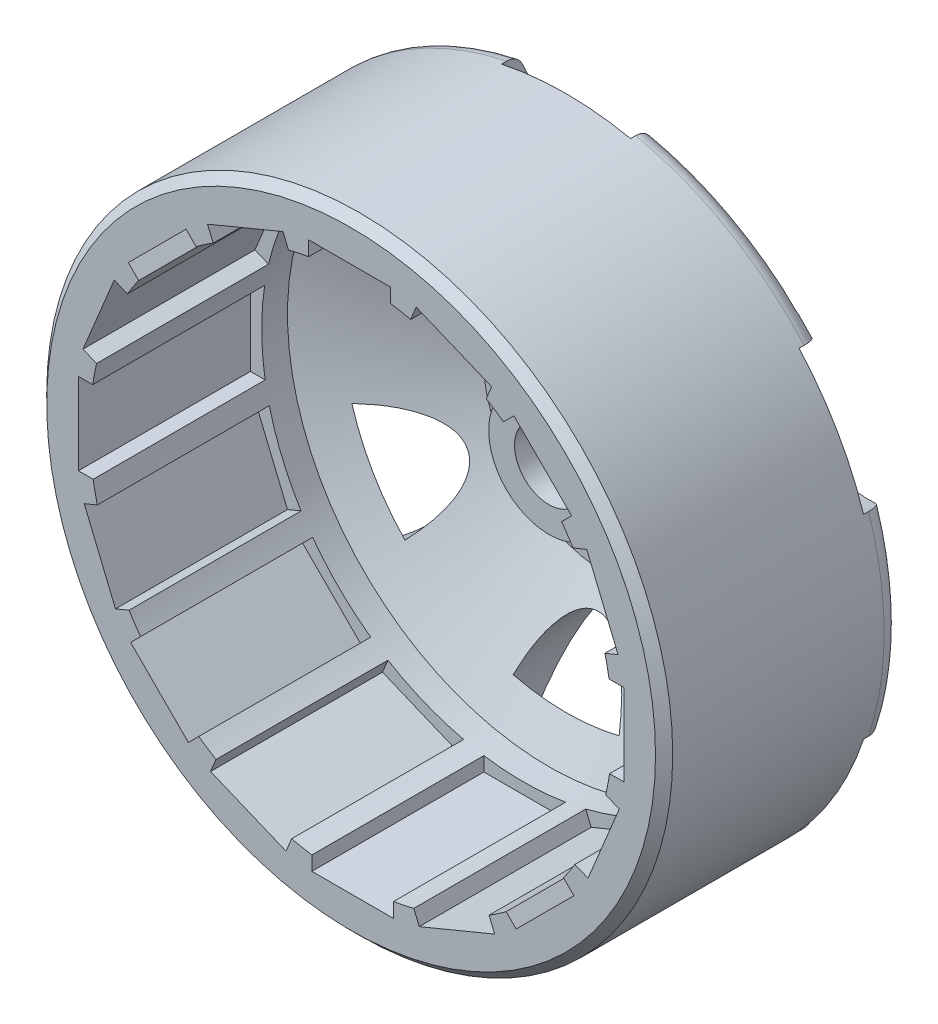
from build123d import *

# Parameters (mm, degrees)
SKETCH3_R          = 4
CUT_EXTRUDE2_DEPTH = 20
SKETCH4_RX         = 17.609555042
SKETCH4_RY         = 7.5
CUT_EXTRUDE4_DEPTH = 10
CUT_EXTRUDE5_START = -20
CUT_EXTRUDE5_DEPTH = 20


with BuildPart() as part:
    # Sketch1 → Revolve1 (revolve)
    with BuildSketch(Plane(origin=(0, 0, 0), x_dir=(1, 0, 0), z_dir=(0, 1, 0)), mode=Mode.PRIVATE) as revolve1_sk:
        with BuildLine():
            Line((0, 14.5), (-7, 14.5))
            Line((-7, 14.5), (-7, 12))
            Line((-7, 12), (-18.32, 12))
            Line((-18.32, 12), (-35.219110084, 4.413431506))
            ThreePointArc((-35.219110084, 4.413431506), (-36.079020573, 3.675548277), (-36.4, 2.588860688))
            Line((-36.4, 2.588860688), (-36.4, -22))
            Line((-36.4, -22), (-35.4, -23))
            Line((-35.4, -23), (-30.4, -23))
            Line((-30.4, -23), (-30.4, 0))
            Line((-30.4, 0), (-14.7, 7.048248385))
            Line((-14.7, 7.048248385), (-10.65, 7.048248385))
            Line((-10.65, 7.048248385), (-7, 0))
            Line((-7, 0), (0, 0))
            Line((0, 0), (0, 14.5))
        make_face()
    revolve(revolve1_sk.sketch.rotate(Axis((0, 0, 0), (0, 0, -1)), 180), axis=Axis((0, 0, 0), (0, 0, -1)))

    # Sketch3 → Cut-Extrude2 (cut)
    with BuildSketch(Plane.XY):
        Circle(SKETCH3_R)
    extrude(amount=-CUT_EXTRUDE2_DEPTH, mode=Mode.SUBTRACT)

    # Sketch4 → Cut-Extrude4 (cut)
    with BuildSketch(Plane(origin=(0, 0, -12), x_dir=(-1, 0, 0), z_dir=(0, 0, -1))):
        with Locations(Location((0, 35.219110084), (0, 0, -90))):
            Ellipse(SKETCH4_RX, SKETCH4_RY)
        with Locations(Location((30.500644032, 17.609555042), (0, 0, -150))):
            Ellipse(SKETCH4_RX, SKETCH4_RY)
        with Locations(Location((30.500644032, -17.609555042), (0, 0, 150))):
            Ellipse(SKETCH4_RX, SKETCH4_RY)
        with Locations(Location((0, -35.219110084), (0, 0, 90))):
            Ellipse(SKETCH4_RX, SKETCH4_RY)
        with Locations(Location((-30.500644032, -17.609555042), (0, 0, 30))):
            Ellipse(SKETCH4_RX, SKETCH4_RY)
        with Locations(Location((-30.500644032, 17.609555042), (0, 0, -30))):
            Ellipse(SKETCH4_RX, SKETCH4_RY)
    extrude(amount=-CUT_EXTRUDE4_DEPTH, mode=Mode.SUBTRACT)

    # Sketch6 → Cut-Extrude5 (cut)
    with BuildSketch(Plane.XY.offset(23).offset(CUT_EXTRUDE5_START)):
        with BuildLine():
            Line((7.570390601, 31.182442693), (6.916094272, 29.602831622))
            ThreePointArc((6.916094272, 29.602831622), (11.456678186, 28.15856042), (15.715818496, 26.022548857))
            Line((15.715818496, 26.022548857), (16.347246159, 27.546950085))
            Line((16.347246159, 27.546950085), (7.570390601, 31.182442693))
        make_face()
        with BuildLine():
            Line((-4.93887527, 31.705883637), (4.56112473, 31.705883637))
            Line((4.56112473, 31.705883637), (4.56112473, 30.055883637))
            ThreePointArc((4.56112473, 30.055883637), (-0.191224066, 30.399398569), (-4.93887527, 29.996124934))
            Line((-4.93887527, 29.996124934), (-4.93887527, 31.705883637))
        make_face()
        with BuildLine():
            Line((18.927133128, 25.911757518), (17.718151155, 24.702775545))
            ThreePointArc((17.718151155, 24.702775545), (21.360405038, 21.630836706), (24.47792136, 18.027516908))
            Line((24.47792136, 18.027516908), (25.644647549, 19.194243097))
            Line((25.644647549, 19.194243097), (18.927133128, 25.911757518))
        make_face()
        with BuildLine():
            Line((27.402391212, 16.696242152), (25.822780141, 16.041945823))
            ThreePointArc((25.822780141, 16.041945823), (28.012203857, 11.810014187), (29.513482591, 7.28795893))
            Line((29.513482591, 7.28795893), (31.037883819, 7.919386593))
            Line((31.037883819, 7.919386593), (27.402391212, 16.696242152))
        make_face()
        with BuildLine():
            Line((31.705883637, 4.93887527), (29.996124934, 4.93887527))
            ThreePointArc((29.996124934, 4.93887527), (30.399398569, 0.191224066), (30.055883637, -4.56112473))
            Line((30.055883637, -4.56112473), (31.705883637, -4.56112473))
            Line((31.705883637, -4.56112473), (31.705883637, 4.93887527))
        make_face()
        with BuildLine():
            Line((31.182442693, -7.570390601), (29.602831622, -6.916094272))
            ThreePointArc((29.602831622, -6.916094272), (28.15856042, -11.456678186), (26.022548857, -15.715818496))
            Line((26.022548857, -15.715818496), (27.546950085, -16.347246159))
            Line((27.546950085, -16.347246159), (31.182442693, -7.570390601))
        make_face()
        with BuildLine():
            Line((25.911757518, -18.927133128), (24.702775545, -17.718151155))
            ThreePointArc((24.702775545, -17.718151155), (21.630836706, -21.360405038), (18.027516908, -24.47792136))
            Line((18.027516908, -24.47792136), (19.194243097, -25.644647549))
            Line((19.194243097, -25.644647549), (25.911757518, -18.927133128))
        make_face()
        with BuildLine():
            Line((16.696242152, -27.402391212), (16.041945823, -25.822780141))
            ThreePointArc((16.041945823, -25.822780141), (11.810014187, -28.012203857), (7.28795893, -29.513482591))
            Line((7.28795893, -29.513482591), (7.919386593, -31.037883819))
            Line((7.919386593, -31.037883819), (16.696242152, -27.402391212))
        make_face()
        with BuildLine():
            Line((4.93887527, -31.705883637), (4.93887527, -29.996124934))
            ThreePointArc((4.93887527, -29.996124934), (0.191224066, -30.399398569), (-4.56112473, -30.055883637))
            Line((-4.56112473, -30.055883637), (-4.56112473, -31.705883637))
            Line((-4.56112473, -31.705883637), (4.93887527, -31.705883637))
        make_face()
        with BuildLine():
            Line((-7.570390601, -31.182442693), (-6.916094272, -29.602831622))
            ThreePointArc((-6.916094272, -29.602831622), (-11.456678186, -28.15856042), (-15.715818496, -26.022548857))
            Line((-15.715818496, -26.022548857), (-16.347246159, -27.546950085))
            Line((-16.347246159, -27.546950085), (-7.570390601, -31.182442693))
        make_face()
        with BuildLine():
            Line((-18.927133128, -25.911757518), (-17.718151155, -24.702775545))
            ThreePointArc((-17.718151155, -24.702775545), (-21.360405038, -21.630836706), (-24.47792136, -18.027516908))
            Line((-24.47792136, -18.027516908), (-25.644647549, -19.194243097))
            Line((-25.644647549, -19.194243097), (-18.927133128, -25.911757518))
        make_face()
        with BuildLine():
            Line((-27.402391212, -16.696242152), (-25.822780141, -16.041945823))
            ThreePointArc((-25.822780141, -16.041945823), (-28.012203857, -11.810014187), (-29.513482591, -7.28795893))
            Line((-29.513482591, -7.28795893), (-31.037883819, -7.919386593))
            Line((-31.037883819, -7.919386593), (-27.402391212, -16.696242152))
        make_face()
        with BuildLine():
            Line((-31.705883637, -4.93887527), (-29.996124934, -4.93887527))
            ThreePointArc((-29.996124934, -4.93887527), (-30.399398569, -0.191224066), (-30.055883637, 4.56112473))
            Line((-30.055883637, 4.56112473), (-31.705883637, 4.56112473))
            Line((-31.705883637, 4.56112473), (-31.705883637, -4.93887527))
        make_face()
        with BuildLine():
            Line((-31.182442693, 7.570390601), (-29.602831622, 6.916094272))
            ThreePointArc((-29.602831622, 6.916094272), (-28.15856042, 11.456678186), (-26.022548857, 15.715818496))
            Line((-26.022548857, 15.715818496), (-27.546950085, 16.347246159))
            Line((-27.546950085, 16.347246159), (-31.182442693, 7.570390601))
        make_face()
        with BuildLine():
            Line((-25.911757518, 18.927133128), (-24.702775545, 17.718151155))
            ThreePointArc((-24.702775545, 17.718151155), (-21.630836706, 21.360405038), (-18.027516908, 24.47792136))
            Line((-18.027516908, 24.47792136), (-19.194243097, 25.644647549))
            Line((-19.194243097, 25.644647549), (-25.911757518, 18.927133128))
        make_face()
        with BuildLine():
            Line((-16.696242152, 27.402391212), (-16.041945823, 25.822780141))
            ThreePointArc((-16.041945823, 25.822780141), (-11.810014187, 28.012203857), (-7.28795893, 29.513482591))
            Line((-7.28795893, 29.513482591), (-7.919386593, 31.037883819))
            Line((-7.919386593, 31.037883819), (-16.696242152, 27.402391212))
        make_face()
    extrude(amount=CUT_EXTRUDE5_DEPTH, mode=Mode.SUBTRACT)


solid = part.part
